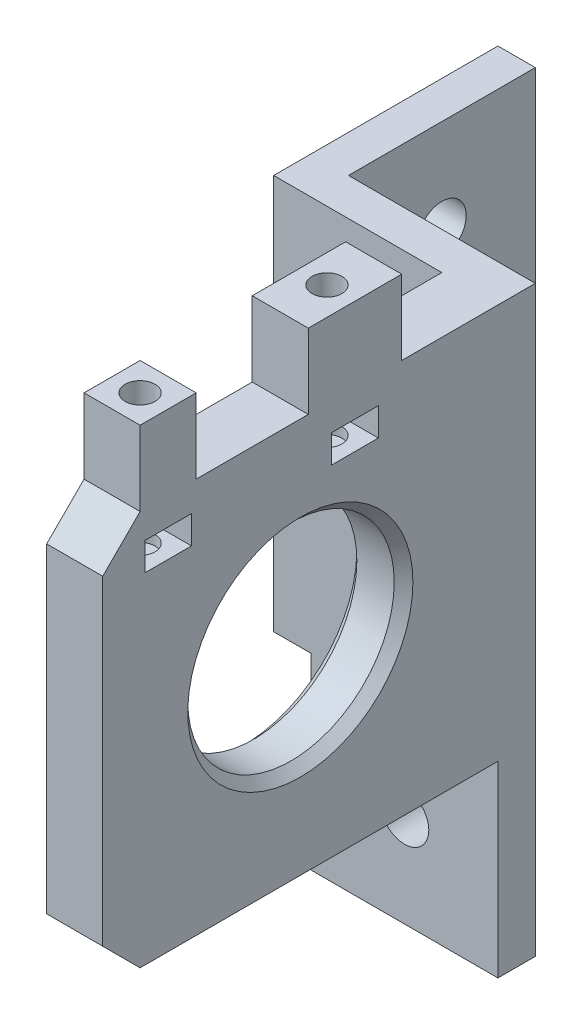
from build123d import *

# Parameters (mm, degrees)
SKICA2_W                 = 20
SKICA2_H                 = 42.3
P_IDAT_VYSUNUT_M1_DEPTH  = 4
SKICA3_W                 = 24
SKICA3_H                 = 42.3
P_IDAT_VYSUNUT_M2_DEPTH  = 4
SKICA4_W                 = 6
SKICA4_H                 = 42.3
P_IDAT_VYSUNUT_M3_DEPTH  = 42.3
SKICA5_R                 = 11.05
ODEBRAT_VYSUNUT_M1_DEPTH = 7
SKICA7_R                 = 2.6
ODEBRAT_VYSUNUT_M3_DEPTH = 4
ZKOSEN_1_SIZE            = 1
SKICA8_W                 = 20
SKICA8_H                 = 4
P_IDAT_VYSUNUT_M4_DEPTH  = 20.091596743
SKICA9_R                 = 2.6
ODEBRAT_VYSUNUT_M4_DEPTH = 4
ODEBRAT_VYSUNUT_M5_DEPTH = 80
SKICA11_W                = 6
SKICA11_H                = 6
SKICA11_H_2              = 10
P_IDAT_VYSUNUT_M5_DEPTH  = 8
SKICA13_R                = 1.6
ODEBRAT_VYSUNUT_M6_DEPTH = 15
SKICA14_W                = 5
SKICA14_H                = 3
ODEBRAT_VYSUNUT_M7_DEPTH = 15
ZKOSEN_2_SIZE            = 1


with BuildPart() as part:
    # Skica2 → Přidat vysunutím1 (new body)
    with BuildSketch(Plane.XY):
        with Locations((-14.524287798, -61.15)):
            Rectangle(SKICA2_W, SKICA2_H)
    extrude(amount=P_IDAT_VYSUNUT_M1_DEPTH)

    # Skica3 → Přidat vysunutím2 (add)
    with BuildSketch(Plane.ZY.offset(24.524287798)):
        with Locations((-8, -61.15)):
            Rectangle(SKICA3_W, SKICA3_H)
    extrude(amount=P_IDAT_VYSUNUT_M2_DEPTH)

    # Skica4 → Přidat vysunutím3 (add)
    with BuildSketch(Plane.XY.offset(4)):
        with Locations((-7.524287798, -61.15)):
            Rectangle(SKICA4_W, SKICA4_H)
    extrude(amount=P_IDAT_VYSUNUT_M3_DEPTH)

    # Skica5 → Odebrat vysunutím1 (cut)
    with BuildSketch(Plane(origin=(-4.524287798, 0, 0), x_dir=(0, 0, -1), z_dir=(1, 0, 0))):
        with Locations((-25.15, -61.15)):
            Circle(SKICA5_R)
    extrude(amount=-ODEBRAT_VYSUNUT_M1_DEPTH, mode=Mode.SUBTRACT)

    # Skica7 → Odebrat vysunutím3 (cut)
    with BuildSketch(Plane.ZY.offset(28.524287798)):
        with Locations(Location((-10, -50, 0), (0, 0, 270))):
            Circle(SKICA7_R)
        with Locations(Location((-10, -70, 0), (0, 0, 270))):
            Circle(SKICA7_R)
    extrude(amount=-ODEBRAT_VYSUNUT_M3_DEPTH, mode=Mode.SUBTRACT)

    # Zkosení1
    zkosen_1_edges = [part.edges().sort_by_distance(p)[0] for p in [
        (-10.524287798, -61.15, 36.2),
    ]]
    chamfer(zkosen_1_edges, length=ZKOSEN_1_SIZE)

    # Skica8 → Přidat vysunutím4 (add)
    with BuildSketch(Plane.XZ.offset(82.3)):
        with Locations((-14.524287798, 2)):
            Rectangle(SKICA8_W, SKICA8_H)
    extrude(amount=P_IDAT_VYSUNUT_M4_DEPTH)

    # Skica9 → Odebrat vysunutím4 (cut)
    with BuildSketch(Plane.XY.offset(4)):
        with Locations((-14.524287798, -92.391596743)):
            Circle(SKICA9_R)
    extrude(amount=-ODEBRAT_VYSUNUT_M4_DEPTH, mode=Mode.SUBTRACT)

    # Skica10 → Odebrat vysunutím5 (cut)
    with BuildSketch(Plane.ZY.offset(10.524287798)):
        Polygon((46.3, -44), (42.3, -40), (46.565878614, -39.259270079), align=None)
        Polygon((42.3, -82.3), (46.3, -78.3), (47.745576453, -80.3), (46.3, -85.415433185), align=None)
    extrude(amount=-ODEBRAT_VYSUNUT_M5_DEPTH, mode=Mode.SUBTRACT)

    # Skica11 → Přidat vysunutím5 (add)
    with BuildSketch(Plane(origin=(0, -40, 0), x_dir=(1, 0, 0), z_dir=(0, 1, 0))):
        with Locations((-7.524287798, -39.3)):
            Rectangle(SKICA11_W, SKICA11_H)
        with Locations((-7.524287798, -19.3)):
            Rectangle(SKICA11_W, SKICA11_H_2)
    extrude(amount=P_IDAT_VYSUNUT_M5_DEPTH)

    # Skica13 → Odebrat vysunutím6 (cut)
    with BuildSketch(Plane(origin=(0, -32, 0), x_dir=(1, 0, 0), z_dir=(0, 1, 0))):
        with Locations(Location((-7.524287798, -39.3, 0), (0, 0, 270))):
            Circle(SKICA13_R)
        with Locations(Location((-7.524287798, -19.3, 0), (0, 0, 270))):
            Circle(SKICA13_R)
    extrude(amount=-ODEBRAT_VYSUNUT_M6_DEPTH, mode=Mode.SUBTRACT)

    # Skica14 → Odebrat vysunutím7 (cut)
    with BuildSketch(Plane(origin=(-4.524287798, 0, 0), x_dir=(0, 0, -1), z_dir=(1, 0, 0))):
        with Locations((-39.3, -44.438988808)):
            Rectangle(SKICA14_W, SKICA14_H)
        with Locations((-19.3, -44.438988808)):
            Rectangle(SKICA14_W, SKICA14_H)
    extrude(amount=-ODEBRAT_VYSUNUT_M7_DEPTH, mode=Mode.SUBTRACT)

    # Zkosení2
    zkosen_2_edges = [part.edges().sort_by_distance(p)[0] for p in [
        (-4.524287798, -61.15, 36.2),
    ]]
    chamfer(zkosen_2_edges, length=ZKOSEN_2_SIZE)


solid = part.part
